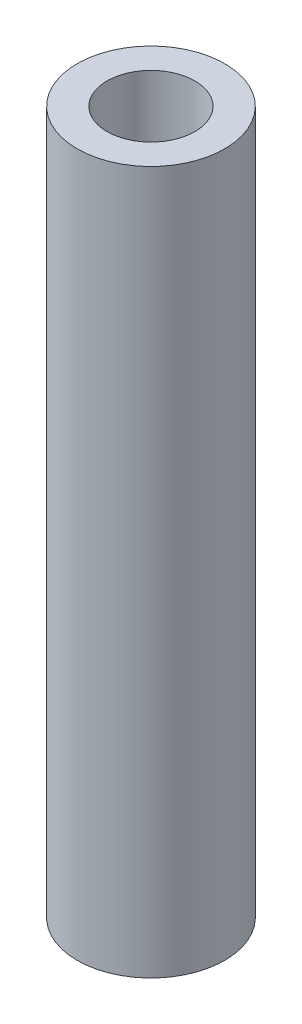
from build123d import *

# Parameters (mm, degrees)
SKETCH3_R           = 10.668
SKETCH3_R_2         = 6.35
BOSS_EXTRUDE1_DEPTH = 101.6


with BuildPart() as part:
    # Sketch3 → Boss-Extrude1 (new body)
    with BuildSketch(Plane(origin=(0, 0, 0), x_dir=(1, 0, 0), z_dir=(0, 1, 0))):
        with Locations(Location((0, 0, 0), (0, 0, 270))):
            Circle(SKETCH3_R)
        with Locations(Location((0, 0, 0), (0, 0, 270))):
            Circle(SKETCH3_R_2, mode=Mode.SUBTRACT)
    extrude(amount=BOSS_EXTRUDE1_DEPTH)


solid = part.part
